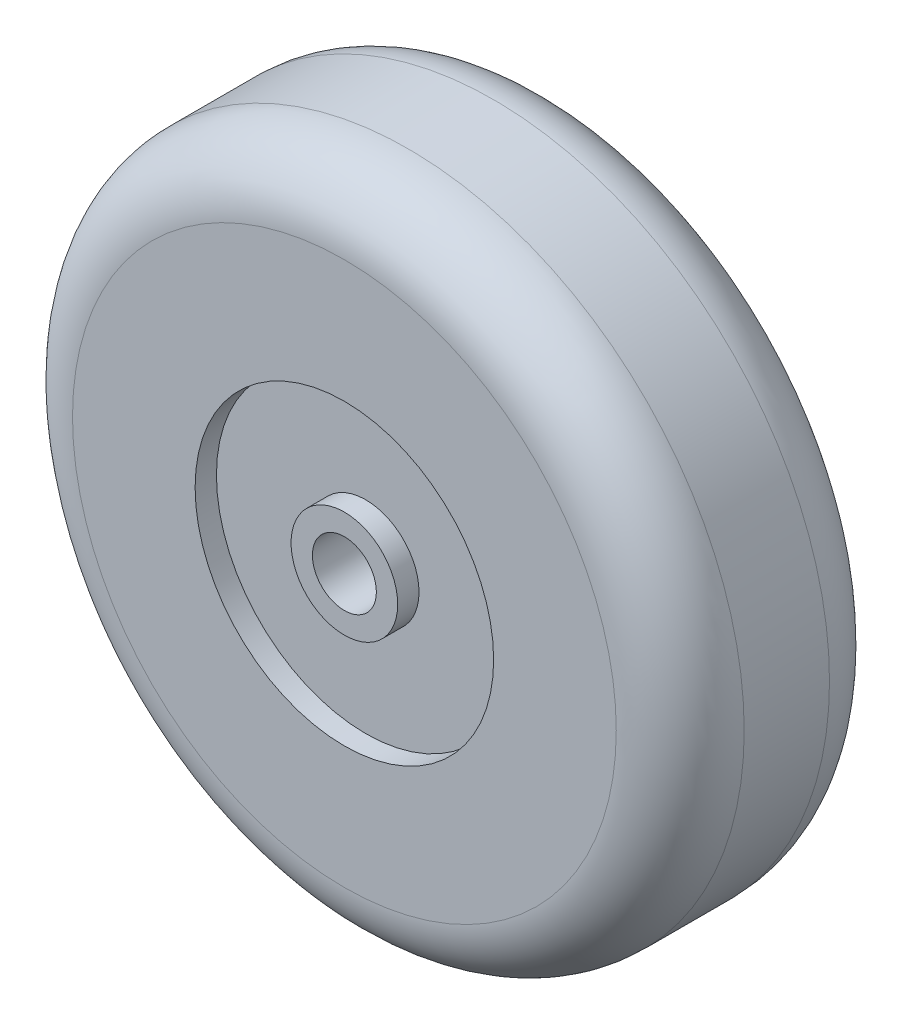
from build123d import *

# Parameters (mm, degrees)
SKETCH1_R           = 15.75
SKETCH1_R_2         = 1.5
BOSS_EXTRUDE1_DEPTH = 10
SKETCH2_R           = 7
SKETCH2_R_2         = 2.5
CUT_EXTRUDE1_DEPTH  = 1
CUT_EXTRUDE2_START  = -1
SKETCH3_R           = 7
SKETCH3_R_2         = 2.5
CUT_EXTRUDE2_DEPTH  = 1
FILLET1_R           = 3


with BuildPart() as part:
    # Sketch1 → Boss-Extrude1 (new body)
    with BuildSketch(Plane.XY):
        with Locations((-62.5, -49.913872362)):
            Circle(SKETCH1_R)
        with Locations((-62.5, -49.913872362)):
            Circle(SKETCH1_R_2, mode=Mode.SUBTRACT)
    extrude(amount=BOSS_EXTRUDE1_DEPTH)

    # Sketch2 → Cut-Extrude1 (cut)
    with BuildSketch(Plane.XY.offset(10)):
        with Locations((-62.5, -49.913872362)):
            Circle(SKETCH2_R)
        with Locations((-62.5, -49.913872362)):
            Circle(SKETCH2_R_2, mode=Mode.SUBTRACT)
    extrude(amount=-CUT_EXTRUDE1_DEPTH, mode=Mode.SUBTRACT)

    # Sketch3 → Cut-Extrude2 (cut)
    with BuildSketch(Plane(origin=(0, 0, 0), x_dir=(-1, 0, 0), z_dir=(0, 0, -1)).offset(CUT_EXTRUDE2_START)):
        with Locations(Location((62.5, -49.913872362, 0), (0, 0, 180))):
            Circle(SKETCH3_R)
        with Locations(Location((62.5, -49.913872362, 0), (0, 0, 180))):
            Circle(SKETCH3_R_2, mode=Mode.SUBTRACT)
    extrude(amount=CUT_EXTRUDE2_DEPTH, mode=Mode.SUBTRACT)

    # Fillet1
    fillet1_edges = [part.edges().sort_by_distance(p)[0] for p in [
        (-78.25, -49.913872362, 0),
        (-78.25, -49.913872362, 10),
    ]]
    fillet(fillet1_edges, radius=FILLET1_R)


solid = part.part
